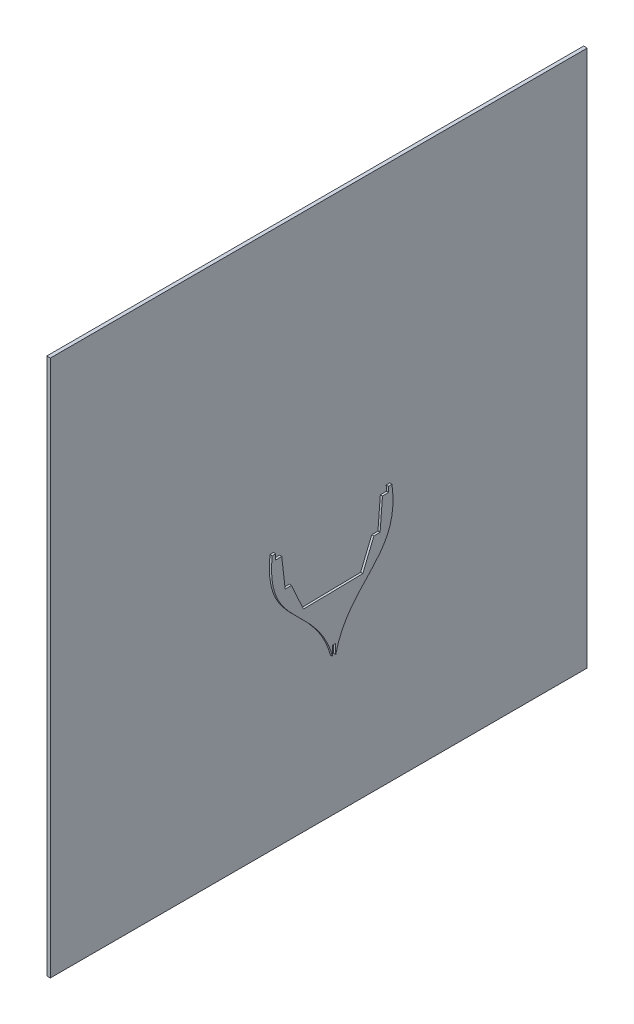
from build123d import *

# Parameters (mm, degrees)
BOSS_EXTRU_2_DEPTH      = 10
BOSS_EXTRU_3_DEPTH      = 6
ENL_V_MAT_EXTRU_1_DEPTH = 6


with BuildPart() as part:
    # Esquisse3D1 → Boss.-Extru.2 (new body)
    with BuildSketch(Plane(origin=(-20, 1121.289346724, 777.274991403), x_dir=(0, -0.7071067811865476, -0.7071067811865476), z_dir=(1, 0, 0))):
        Polygon((0, 0), (1060.66017178, 1060.66017178), (2121.32034356, 0), (1060.66017178, -1060.66017178), align=None)
    extrude(amount=BOSS_EXTRU_2_DEPTH)


with BuildPart() as body_2:
    # Esquisse5 → Boss.-Extru.3 (new body)
    with BuildSketch(Plane(origin=(0, 0, 0), x_dir=(0, 0, -1), z_dir=(1, 0, 0))):
        with BuildLine():
            Line((161.019319027, 354.954433822), (151.019319027, 354.773280049))
            Line((151.019319027, 354.773280049), (151.955063241, 339.597201952))
            Line((151.955063241, 339.597201952), (134.602488793, 339.282853519))
            Line((134.602488793, 339.282853519), (128.010290223, 254.940205779))
            Line((128.010290223, 254.940205779), (110.594025777, 254.624703578))
            Line((110.594025777, 254.624703578), (79.576364721, 179.299786333))
            Line((79.576364721, 179.299786333), (-86.018188614, 176.299978528))
            Line((-86.018188614, 176.299978528), (-119.743681695, 250.452049111))
            Line((-119.743681695, 250.452049111), (-137.159946142, 250.13654691))
            Line((-137.159946142, 250.13654691), (-146.80261473, 334.185093907))
            Line((-146.80261473, 334.185093907), (-164.155189178, 333.870745475))
            Line((-164.155189178, 333.870745475), (-163.769719303, 349.070757864))
            Line((-163.769719303, 349.070757864), (-173.769719303, 348.889604091))
            add(Edge.make_bspline(
                [(0, 0), (-4.612294832, 18.064961959), (-26.68919989, 194.588665588), (-194.943304739, 138.917746092), (-173.769719303, 348.889604091)],
                knots=[0, 0, 0, 0, 0, 1, 1, 1, 1, 1], degree=4))
            add(Edge.make_bspline(
                [(0, 0), (3.954976136, 18.220161304), (19.623907288, 195.427644996), (189.783955234, 145.887225547), (161.019319027, 354.954433822)],
                knots=[0, 0, 0, 0, 0, 1, 1, 1, 1, 1], degree=4))
        make_face()
    extrude(amount=BOSS_EXTRU_3_DEPTH)

    # Esquisse6 → Enlèv. mat.-Extru.1 (cut)
    with BuildSketch(Plane(origin=(6, 0, 0), x_dir=(0, 0, -1), z_dir=(1, 0, 0))):
        Polygon((-4.886282083, 21.241916567), (-5.375397269, 48.241916567), (3.624602731, 48.404954963), (4.113717917, 21.404954963), (117.063261114, -47.52702125), (-85.227699586, -65.220017949), align=None)
    extrude(amount=-ENL_V_MAT_EXTRU_1_DEPTH, mode=Mode.SUBTRACT)


solid = Compound([part.part, body_2.part])
